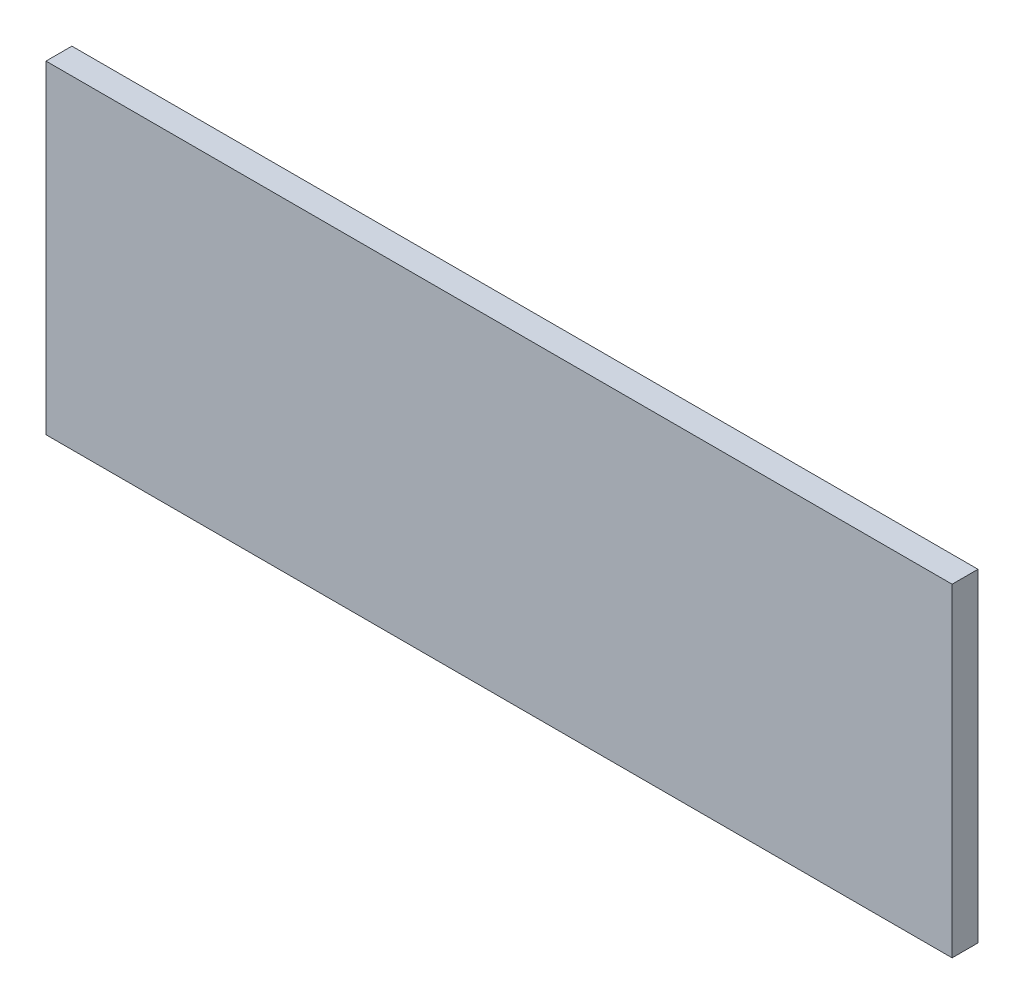
from build123d import *

# Parameters (mm, degrees)
SKETCH_1_W        = 700
SKETCH_1_H        = 250
SKETCH_1_R        = 13
EXTRUDE_672_DEPTH = 20
SKETCH_2_W        = 700
SKETCH_2_H        = 250
EXTRUDE_1_DEPTH   = 20


with BuildPart() as part:
    # 草图1 → Extrude 672 (new body)
    with BuildSketch(Plane.XY):
        Rectangle(SKETCH_1_W, SKETCH_1_H)
        with Locations((-300, 80)):
            Circle(SKETCH_1_R, mode=Mode.SUBTRACT)
        with Locations((-220, 80)):
            Circle(SKETCH_1_R, mode=Mode.SUBTRACT)
        with Locations((-140, 80)):
            Circle(SKETCH_1_R, mode=Mode.SUBTRACT)
        with Locations((-60, 80)):
            Circle(SKETCH_1_R, mode=Mode.SUBTRACT)
        with Locations((-60, 0)):
            Circle(SKETCH_1_R, mode=Mode.SUBTRACT)
        with Locations((-220, 0)):
            Circle(SKETCH_1_R, mode=Mode.SUBTRACT)
        with Locations((-300, 0)):
            Circle(SKETCH_1_R, mode=Mode.SUBTRACT)
        with Locations((-140, 0)):
            Circle(SKETCH_1_R, mode=Mode.SUBTRACT)
        with Locations(Location((-60, -80, 0), (0, 0, 180))):
            Circle(SKETCH_1_R, mode=Mode.SUBTRACT)
        with Locations(Location((-140, -80, 0), (0, 0, 180))):
            Circle(SKETCH_1_R, mode=Mode.SUBTRACT)
        with Locations(Location((-220, -80, 0), (0, 0, 180))):
            Circle(SKETCH_1_R, mode=Mode.SUBTRACT)
        with Locations(Location((-300, -80, 0), (0, 0, 180))):
            Circle(SKETCH_1_R, mode=Mode.SUBTRACT)
        with Locations((300, -80)):
            Circle(SKETCH_1_R, mode=Mode.SUBTRACT)
        with Locations((220, -80)):
            Circle(SKETCH_1_R, mode=Mode.SUBTRACT)
        with Locations((140, -80)):
            Circle(SKETCH_1_R, mode=Mode.SUBTRACT)
        with Locations((60, -80)):
            Circle(SKETCH_1_R, mode=Mode.SUBTRACT)
        with Locations(Location((140, 0, 0), (0, 0, 180))):
            Circle(SKETCH_1_R, mode=Mode.SUBTRACT)
        with Locations(Location((300, 0, 0), (0, 0, 180))):
            Circle(SKETCH_1_R, mode=Mode.SUBTRACT)
        with Locations(Location((220, 0, 0), (0, 0, 180))):
            Circle(SKETCH_1_R, mode=Mode.SUBTRACT)
        with Locations(Location((60, 0, 0), (0, 0, 180))):
            Circle(SKETCH_1_R, mode=Mode.SUBTRACT)
        with Locations(Location((60, 80, 0), (0, 0, 180))):
            Circle(SKETCH_1_R, mode=Mode.SUBTRACT)
        with Locations(Location((140, 80, 0), (0, 0, 180))):
            Circle(SKETCH_1_R, mode=Mode.SUBTRACT)
        with Locations(Location((220, 80, 0), (0, 0, 180))):
            Circle(SKETCH_1_R, mode=Mode.SUBTRACT)
        with Locations(Location((300, 80, 0), (0, 0, 180))):
            Circle(SKETCH_1_R, mode=Mode.SUBTRACT)
    extrude(amount=EXTRUDE_672_DEPTH)

    # 草图2 → 凸台-拉伸1 (add)
    with BuildSketch(Plane.XY.offset(20)):
        Rectangle(SKETCH_2_W, SKETCH_2_H)
    extrude(amount=-EXTRUDE_1_DEPTH)


solid = part.part
